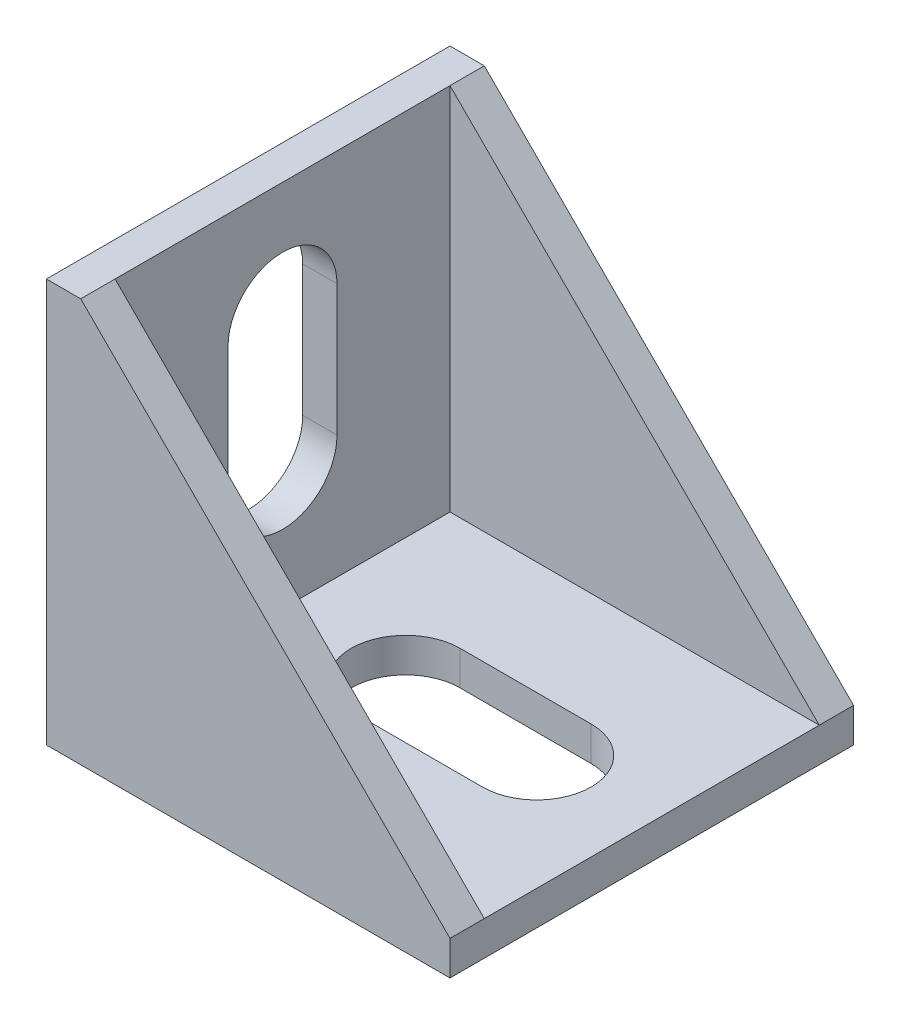
from build123d import *

# Parameters (mm, degrees)
SKICA1_W                 = 20
SKICA1_H                 = 20
P_IDAT_VYSUNUT_M1_DEPTH  = 1.7
SKICA2_W                 = 1.7
SKICA2_H                 = 20
P_IDAT_VYSUNUT_M2_DEPTH  = 18.3
ODEBRAT_VYSUNUT_M1_DEPTH = 1.7
SKICA4_W                 = 1.7
SKICA4_H                 = 18.3
P_IDAT_VYSUNUT_M3_DEPTH  = 18.3
ZKOSEN_1_SIZE            = 18.3


with BuildPart() as part:
    # Skica1 → Přidat vysunutím1 (new body)
    with BuildSketch(Plane(origin=(0, 0, 0), x_dir=(1, 0, 0), z_dir=(0, 1, 0))):
        Rectangle(SKICA1_W, SKICA1_H)
        with BuildLine():
            Line((-2.2, 2.7), (4.3, 2.7))
            ThreePointArc((4.3, 2.7), (7, 0), (4.3, -2.7))
            Line((4.3, -2.7), (-2.2, -2.7))
            ThreePointArc((-2.2, -2.7), (-4.9, 0), (-2.2, 2.7))
        make_face(mode=Mode.SUBTRACT)
    extrude(amount=P_IDAT_VYSUNUT_M1_DEPTH)

    # Skica2 → Přidat vysunutím2 (add)
    with BuildSketch(Plane(origin=(0, 1.7, 0), x_dir=(1, 0, 0), z_dir=(0, 1, 0))):
        with Locations((-9.15, 0)):
            Rectangle(SKICA2_W, SKICA2_H)
    extrude(amount=P_IDAT_VYSUNUT_M2_DEPTH)

    # Skica3 → Odebrat vysunutím1 (cut)
    with BuildSketch(Plane(origin=(-8.3, 0, 0), x_dir=(0, 0, -1), z_dir=(1, 0, 0))):
        with BuildLine():
            Line((2.7, 14.3), (2.7, 7.8))
            ThreePointArc((2.7, 7.8), (0, 5.1), (-2.7, 7.8))
            Line((-2.7, 7.8), (-2.7, 14.3))
            ThreePointArc((-2.7, 14.3), (0, 17), (2.7, 14.3))
        make_face()
    extrude(amount=-ODEBRAT_VYSUNUT_M1_DEPTH, mode=Mode.SUBTRACT)

    # Skica4 → Přidat vysunutím3 (add)
    with BuildSketch(Plane(origin=(-8.3, 0, 0), x_dir=(0, 0, -1), z_dir=(1, 0, 0))):
        with Locations((-9.15, 10.85)):
            Rectangle(SKICA4_W, SKICA4_H)
        with Locations((9.15, 10.85)):
            Rectangle(SKICA4_W, SKICA4_H)
    extrude(amount=P_IDAT_VYSUNUT_M3_DEPTH)

    # Zkosení1
    zkosen_1_edges = [part.edges().sort_by_distance(p)[0] for p in [
        (10, 20, -9.15),
        (10, 20, 9.15),
    ]]
    chamfer(zkosen_1_edges, length=ZKOSEN_1_SIZE)


solid = part.part
